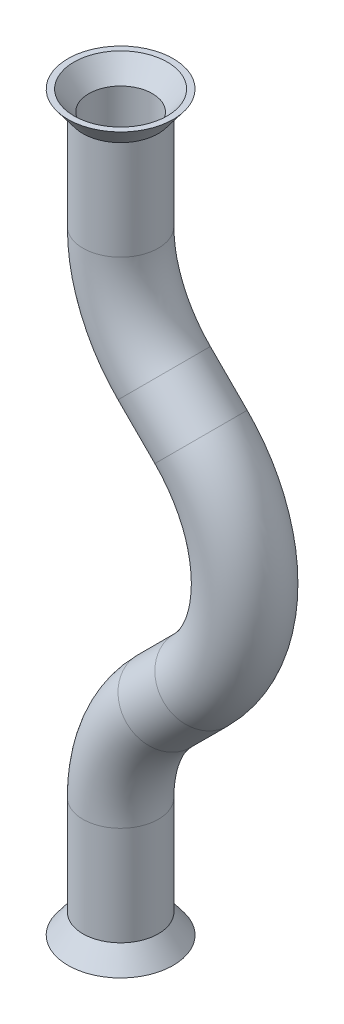
from build123d import *

# Parameters (mm, degrees)
SKETCH1_R           = 4.826
SKETCH1_R_2         = 4.064
SKETCH3_R           = 4.826
BOSS_EXTRUDE1_DEPTH = 2.54
BOSS_EXTRUDE1_DRAFT = -37
SKETCH5_R           = 4.826
BOSS_EXTRUDE2_DEPTH = 2.54
BOSS_EXTRUDE2_DRAFT = -37


with BuildPart() as part:
    # Sweep1: sweep along a path in Sketch2
    with BuildLine(Plane.XY) as sweep1_path:
        Line((0, 0), (0, 12.7))
        ThreePointArc((0, 12.7), (1.450094906, 19.990119387), (5.579615818, 26.170384182))
        Line((5.579615818, 26.170384182), (10.295384182, 30.886152545))
        ThreePointArc((10.295384182, 30.886152545), (15.875, 44.356536726), (10.295384182, 57.826920908))
        Line((10.295384182, 57.826920908), (5.579615818, 62.542689271))
        ThreePointArc((5.579615818, 62.542689271), (1.450094906, 68.722954066), (0, 76.013073453))
        Line((0, 76.013073453), (0, 88.713073453))
    # Sketch1 → Sweep1 (sweep)
    with BuildSketch(Plane(origin=(0, 0, 0), x_dir=(1, 0, 0), z_dir=(0, 1, 0))):
        Circle(SKETCH1_R)
        Circle(SKETCH1_R_2, mode=Mode.SUBTRACT)
    sweep(path=sweep1_path.line)


with BuildPart() as boss_extrude1_tool:
    # Sketch3 → Boss-Extrude1 (with draft: the straight prism first)
    with BuildSketch(Plane.XZ):
        with Locations(Location((0, 0, 0), (0, 0, 180))):
            Circle(SKETCH3_R)
    extrude(amount=BOSS_EXTRUDE1_DEPTH)
    # Boss-Extrude1: the draft: its side faces are tilted about the plane it starts from
    boss_extrude1_sides = [boss_extrude1_tool.faces().sort_by_distance(p)[0] for p in [
        (4.826, -1.27, 0),
    ]]
    draft(boss_extrude1_sides, Plane.XZ, BOSS_EXTRUDE1_DRAFT)


with BuildPart() as part_1:
    add(part.part)

    # Boss-Extrude1: add boss_extrude1_tool
    add(boss_extrude1_tool.part)

    # Cut-Extrude1 cone 1 section (through the dimple's axis) → Cut-Extrude1 (revolve, cut)
    with BuildSketch(Plane(origin=(0, -2.54, 0), x_dir=(0, 0, -1), z_dir=(1, 0, 0))):
        Polygon((0, 0), (5.978027287, 0), (0, 7.933110155), align=None)
    revolve(axis=Axis((0, -2.54, 0), (0, 1, 0)), mode=Mode.SUBTRACT)


with BuildPart() as boss_extrude2_tool:
    # Sketch5 → Boss-Extrude2 (with draft: the straight prism first)
    with BuildSketch(Plane(origin=(0, 88.713073453, 0), x_dir=(0, 0, -1), z_dir=(0, 1, 0))):
        with Locations(Location((0, 0, 0), (0, 0, 90))):
            Circle(SKETCH5_R)
    extrude(amount=BOSS_EXTRUDE2_DEPTH)
    # Boss-Extrude2: the draft: its side faces are tilted about the plane it starts from
    boss_extrude2_sides = [boss_extrude2_tool.faces().sort_by_distance(p)[0] for p in [
        (4.826, 89.983073453, 0),
    ]]
    draft(boss_extrude2_sides, Plane(origin=(0, 88.713073453, 0), x_dir=(0, 0, -1), z_dir=(0, 1, 0)), BOSS_EXTRUDE2_DRAFT)


with BuildPart() as part_2:
    add(part_1.part)

    # Boss-Extrude2: add boss_extrude2_tool
    add(boss_extrude2_tool.part)

    # Cut-Extrude2 cone 1 section (through the dimple's axis) → Cut-Extrude2 (revolve, cut)
    with BuildSketch(Plane(origin=(0, 91.253073453, 0), x_dir=(0, 0, 1), z_dir=(1, 0, 0))):
        Polygon((0, 0), (5.978027287, 0), (0, 7.933110155), align=None)
    revolve(axis=Axis((0, 91.253073453, 0), (0, -1, 0)), mode=Mode.SUBTRACT)


solid = part_2.part
